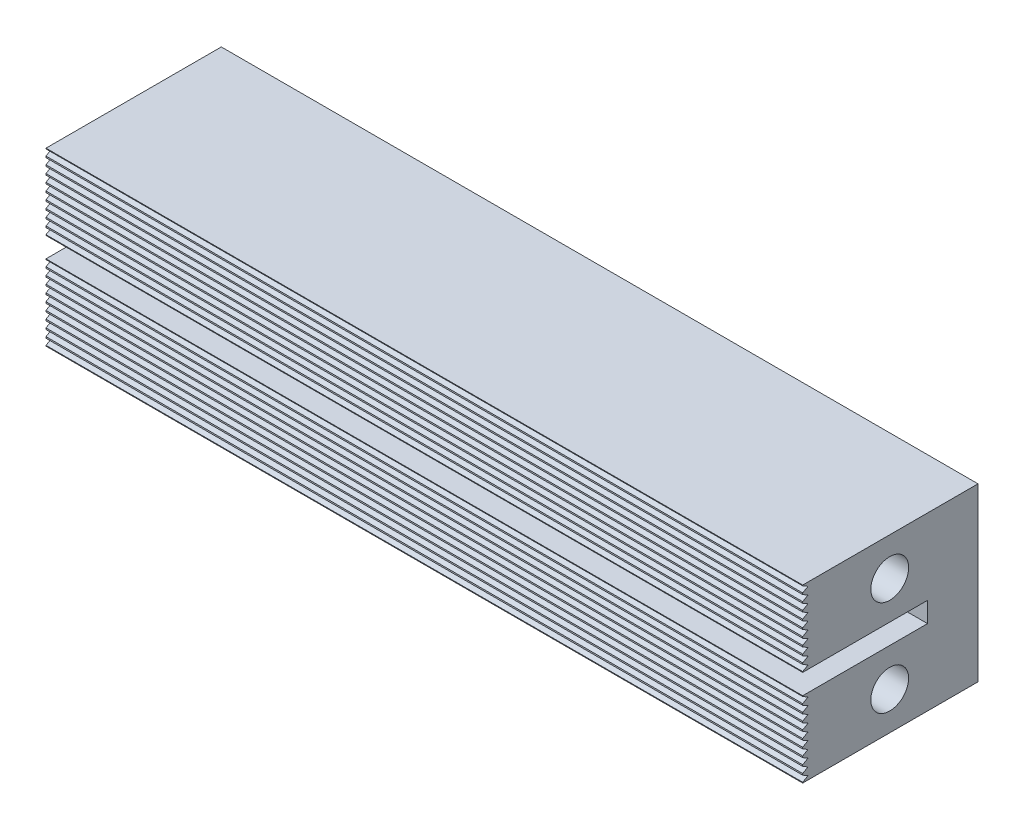
from build123d import *

# Parameters (mm, degrees)
SKETCH1_W           = 150
SKETCH1_H           = 34
BOSS_EXTRUDE1_DEPTH = 35
CUT_EXTRUDE1_DEPTH  = 160
SKETCH7_R           = 3.75
CUT_EXTRUDE9_DEPTH  = 160
CUT_EXTRUDE11_DEPTH = 158.737123088
SKETCH8_W           = 0.25
SKETCH8_H           = 34
CUT_EXTRUDE12_DEPTH = 158.737123088
SKETCH9_R           = 4
CUT_EXTRUDE13_DEPTH = 5


with BuildPart() as part:
    # Sketch1 → Boss-Extrude1 (new body)
    with BuildSketch(Plane.XY):
        with Locations((75, 17)):
            Rectangle(SKETCH1_W, SKETCH1_H)
    extrude(amount=BOSS_EXTRUDE1_DEPTH)

    # Sketch2 → Cut-Extrude1 (cut)
    with BuildSketch(Plane(origin=(150, 0, 0), x_dir=(0, 0, -1), z_dir=(1, 0, 0))):
        Polygon((-35, 17), (-35, 19), (-10, 19), (-10, 15), (-35, 15), align=None)
    extrude(amount=-CUT_EXTRUDE1_DEPTH, mode=Mode.SUBTRACT)

    # Sketch7 → Cut-Extrude9 (cut)
    with BuildSketch(Plane(origin=(150, 0, 0), x_dir=(0, 0, -1), z_dir=(1, 0, 0))):
        with Locations((-17.5, 26.5)):
            Circle(SKETCH7_R)
        with Locations((-17.5, 7.5)):
            Circle(SKETCH7_R)
    extrude(amount=-CUT_EXTRUDE9_DEPTH, mode=Mode.SUBTRACT)

    # Sketch3 → Cut-Extrude11 (cut, through all)
    with BuildSketch(Plane(origin=(150, 0, 0), x_dir=(0, 0, -1), z_dir=(1, 0, 0))):
        Polygon((-33.7, 19.75), (-35, 20.5), (-35, 19), align=None)
        Polygon((-33.7, 21.25), (-35, 22), (-35, 20.5), align=None)
        Polygon((-33.7, 22.75), (-35, 23.5), (-35, 22), align=None)
        Polygon((-33.7, 24.25), (-35, 25), (-35, 23.5), align=None)
        Polygon((-33.7, 25.75), (-35, 26.5), (-35, 25), align=None)
        Polygon((-33.7, 27.25), (-35, 28), (-35, 26.5), align=None)
        Polygon((-33.7, 28.75), (-35, 29.5), (-35, 28), align=None)
        Polygon((-33.7, 30.25), (-35, 31), (-35, 29.5), align=None)
        Polygon((-35, 34.75), (-35, 34), (-33.7, 34.75), align=None)
        Polygon((-35, 34), (-35, 32.5), (-33.7, 33.25), align=None)
        Polygon((-33.7, 31.75), (-35, 32.5), (-35, 31), align=None)
    cut_extrude11 = extrude(amount=-CUT_EXTRUDE11_DEPTH, mode=Mode.SUBTRACT)

    # Mirror1: Cut-Extrude11 across plane
    add(cut_extrude11.mirror(Plane.ZX.offset(17)), mode=Mode.SUBTRACT)

    # Sketch8 → Cut-Extrude12 (cut, through all)
    with BuildSketch(Plane(origin=(150, 0, 0), x_dir=(0, 0, -1), z_dir=(1, 0, 0))):
        with Locations((-34.875, 17)):
            Rectangle(SKETCH8_W, SKETCH8_H)
    extrude(amount=-CUT_EXTRUDE12_DEPTH, mode=Mode.SUBTRACT)

    # Sketch9 → Cut-Extrude13 (cut)
    with BuildSketch(Plane(origin=(0, 0, 0), x_dir=(-1, 0, 0), z_dir=(0, 0, -1))):
        with Locations((-50, 17)):
            Circle(SKETCH9_R)
        with Locations((-100, 17)):
            Circle(SKETCH9_R)
    extrude(amount=-CUT_EXTRUDE13_DEPTH, mode=Mode.SUBTRACT)


solid = part.part
